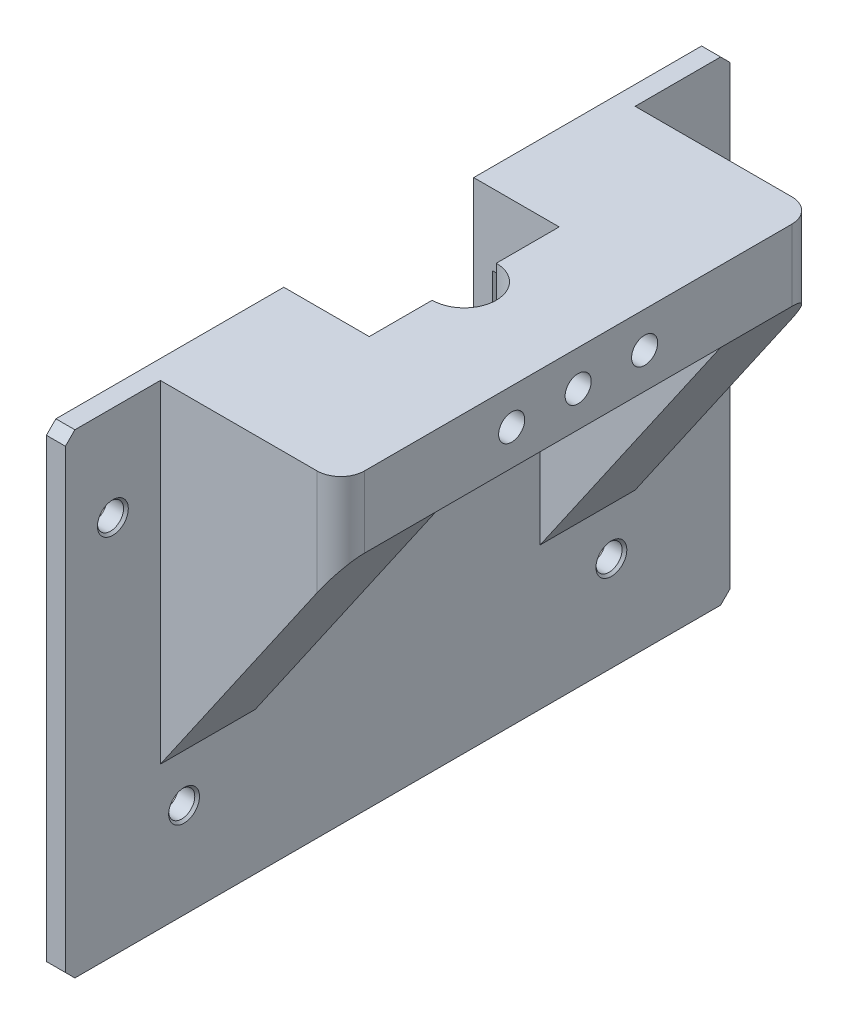
from build123d import *

# Parameters (mm, degrees)
SKETCH_1_W          = 140
SKETCH_1_H          = 100
EXTRUDE_1_DEPTH     = 4
SKETCH_9_R          = 2.75
CUT_EXTRUDE_3_DEPTH = 8
CHAMFER_2_SIZE      = 2
SKETCH_11_W         = 40
SKETCH_11_H         = 50
CUT_EXTRUDE_5_DEPTH = 5
SKETCH_12_W         = 10
SKETCH_12_H         = 15
EXTRUDE_2_DEPTH     = 14
SKETCH_13_W         = 60
SKETCH_13_H         = 15
EXTRUDE_3_DEPTH     = 14
EXTRUDE_4_DEPTH     = 20
EXTRUDE_5_DEPTH     = 20
SKETCH_16_R         = 6.75
CUT_EXTRUDE_6_DEPTH = 20
EXTRUDE_6_DEPTH     = 10
SKETCH_18_R         = 2.75
CUT_EXTRUDE_7_DEPTH = 96.268042911
SKETCH_19_R         = 2.75
CUT_EXTRUDE_8_DEPTH = 100
CHAMFER_3_SIZE      = 0.5
EXTRUDE_7_DEPTH     = 20
EXTRUDE_8_DEPTH     = 20
FILLET_1_R          = 5


with BuildPart() as part:
    # 草图1 → 凸台-拉伸1 (new body)
    with BuildSketch(Plane(origin=(0, 0, 0), x_dir=(0, 0, -1), z_dir=(1, 0, 0))):
        with Locations((0, -10)):
            Rectangle(SKETCH_1_W, SKETCH_1_H)
    extrude(amount=EXTRUDE_1_DEPTH)

    # 草图9 → 切除-拉伸3 (cut)
    with BuildSketch(Plane(origin=(4, 0, 0), x_dir=(0, 0, -1), z_dir=(1, 0, 0))):
        with Locations((-60, 20)):
            Circle(SKETCH_9_R)
        with Locations((60, 20)):
            Circle(SKETCH_9_R)
        with Locations((-45, -40)):
            Circle(SKETCH_9_R)
        with Locations((45, -40)):
            Circle(SKETCH_9_R)
    extrude(amount=-CUT_EXTRUDE_3_DEPTH, mode=Mode.SUBTRACT)

    # 倒角2
    chamfer_2_edges = [part.edges().sort_by_distance(p)[0] for p in [
        (2, 40, 70),
        (2, 40, -70),
        (2, -60, -70),
        (2, -60, 70),
    ]]
    chamfer(chamfer_2_edges, length=CHAMFER_2_SIZE)

    # 草图11 → 切除-拉伸5 (cut)
    with BuildSketch(Plane(origin=(4, 0, 0), x_dir=(0, 0, -1), z_dir=(1, 0, 0))):
        with Locations((0, 15)):
            Rectangle(SKETCH_11_W, SKETCH_11_H)
    extrude(amount=-CUT_EXTRUDE_5_DEPTH, mode=Mode.SUBTRACT)

    # 草图12 → 凸台-拉伸2 (add)
    with BuildSketch(Plane(origin=(4, 0, 0), x_dir=(0, 0, -1), z_dir=(1, 0, 0))):
        with Locations((-25, 32.5)):
            Rectangle(SKETCH_12_W, SKETCH_12_H)
        with Locations((25, 32.5)):
            Rectangle(SKETCH_12_W, SKETCH_12_H)
    extrude(amount=EXTRUDE_2_DEPTH)

    # 草图13 → 凸台-拉伸3 (add)
    with BuildSketch(Plane(origin=(18, 0, 0), x_dir=(0, 0, -1), z_dir=(1, 0, 0))):
        with Locations((0, 32.5)):
            Rectangle(SKETCH_13_W, SKETCH_13_H)
    extrude(amount=EXTRUDE_3_DEPTH)

    # 草图14 → 凸台-拉伸4 (add)
    with BuildSketch(Plane.XY.offset(30)):
        Polygon((4, 40), (4, -30), (32, 25), (32, 40), align=None)
    extrude(amount=EXTRUDE_4_DEPTH)

    # 草图15 → 凸台-拉伸5 (add)
    with BuildSketch(Plane(origin=(0, 0, -30), x_dir=(-1, 0, 0), z_dir=(0, 0, -1))):
        Polygon((-4, 40), (-32, 40), (-32, 25), (-4, -30), align=None)
    extrude(amount=EXTRUDE_5_DEPTH)

    # 草图16 → 切除-拉伸6 (cut)
    with BuildSketch(Plane(origin=(0, 40, 0), x_dir=(1, 0, 0), z_dir=(0, 1, 0))):
        with Locations((18, 0)):
            Circle(SKETCH_16_R)
    extrude(amount=-CUT_EXTRUDE_6_DEPTH, mode=Mode.SUBTRACT)

    # 草图17 → 凸台-拉伸6 (add)
    with BuildSketch(Plane(origin=(32, 0, 0), x_dir=(0, 0, -1), z_dir=(1, 0, 0))):
        Polygon((50, 40), (-50, 40), (-50, 25), (-30, 25), (30, 25), (50, 25), align=None)
    extrude(amount=EXTRUDE_6_DEPTH)

    # 草图18 → 切除-拉伸7 (cut, through all)
    with BuildSketch(Plane.ZY.offset(-18)):
        with Locations((14, 32.5)):
            Circle(SKETCH_18_R)
        with Locations((-14, 32.5)):
            Circle(SKETCH_18_R)
    extrude(amount=-CUT_EXTRUDE_7_DEPTH, mode=Mode.SUBTRACT)

    # 草图19 → 切除-拉伸8 (cut)
    with BuildSketch(Plane(origin=(42, 0, 0), x_dir=(0, 0, -1), z_dir=(1, 0, 0))):
        with Locations((0, 32.5)):
            Circle(SKETCH_19_R)
    extrude(amount=-CUT_EXTRUDE_8_DEPTH, mode=Mode.SUBTRACT)

    # 倒角3
    chamfer_3_edges = [part.edges().sort_by_distance(p)[0] for p in [
        (4, 20, 62.75),
        (4, -40, -42.25),
        (4, -40, 47.75),
        (4, 20, -57.25),
    ]]
    chamfer(chamfer_3_edges, length=CHAMFER_3_SIZE)

    # 草图20 → 凸台-拉伸7 (add)
    with BuildSketch(Plane.XY.offset(50)):
        Polygon((42, 25), (4, -30), (32, 25), align=None)
    extrude(amount=-EXTRUDE_7_DEPTH)

    # 草图21 → 凸台-拉伸8 (add)
    with BuildSketch(Plane(origin=(0, 0, -50), x_dir=(-1, 0, 0), z_dir=(0, 0, -1))):
        Polygon((-42, 25), (-4, -30), (-32, 25), align=None)
    extrude(amount=-EXTRUDE_8_DEPTH)

    # 圆角1
    fillet_1_edges = [part.edges().sort_by_distance(p)[0] for p in [
        (42, 32.5, -50),
        (42, 32.5, 50),
    ]]
    fillet(fillet_1_edges, radius=FILLET_1_R)


solid = part.part
